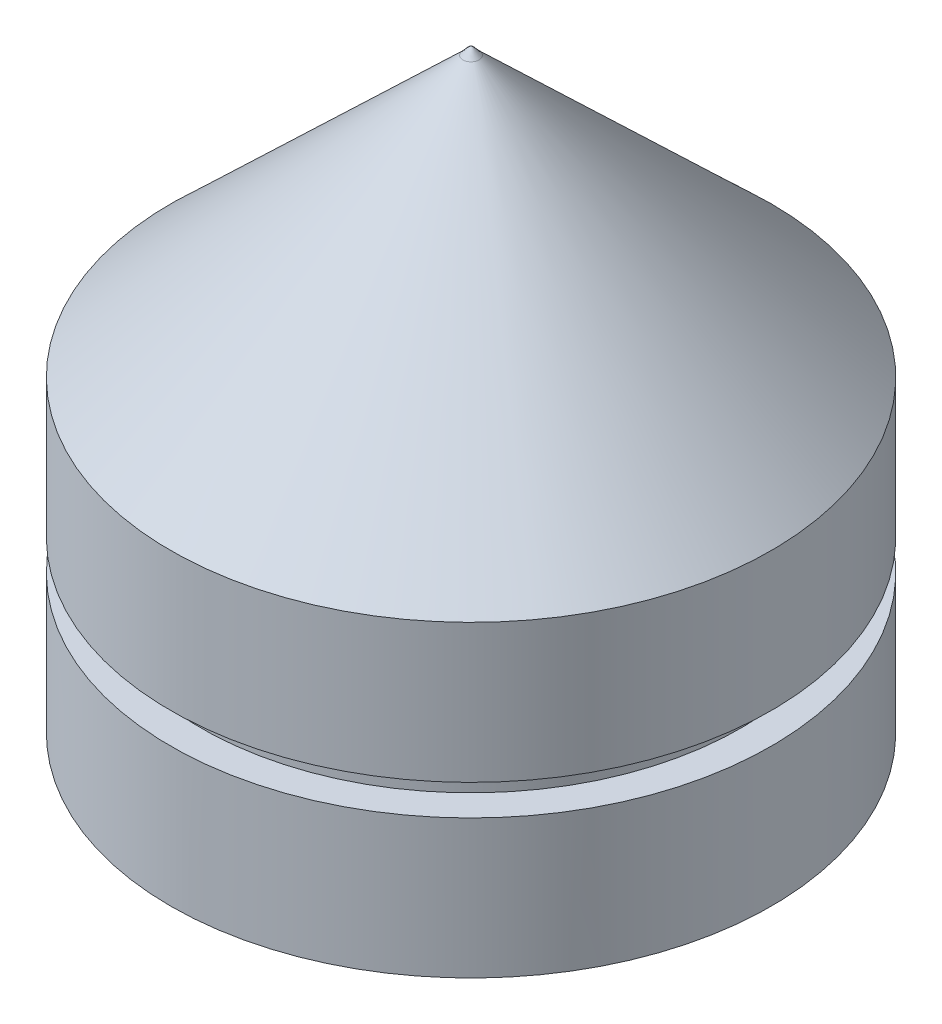
from build123d import *

# Parameters (mm, degrees)
SKETCH1_R           = 9.75
BOSS_EXTRUDE1_DEPTH = 10
SKETCH5_W           = 1
SKETCH5_H           = 1


with BuildPart() as part:
    # Sketch1 → Boss-Extrude1 (new body)
    with BuildSketch(Plane(origin=(0, 0, 0), x_dir=(1, 0, 0), z_dir=(0, 1, 0))):
        with Locations(Location((0, 0, 0), (0, 0, 270))):
            Circle(SKETCH1_R)
    extrude(amount=BOSS_EXTRUDE1_DEPTH)

    # Sketch2 → Revolve1 (revolve)
    with BuildSketch(Plane.XY, mode=Mode.PRIVATE) as revolve1_sk:
        Polygon((0, 10), (0, 19.300191168), (9.75, 10), align=None)
    revolve(revolve1_sk.sketch.rotate(Axis((0, 0, 0), (0, 1, 0)), 90), axis=Axis((0, 0, 0), (0, 1, 0)))

    # Sketch3 → Cut-Revolve1 (revolve, cut)
    with BuildSketch(Plane.XY, mode=Mode.PRIVATE) as cut_revolve1_sk:
        Polygon((0, 19.300191168), (0, 19.050191168), (0.262091387, 19.050191168), align=None)
    revolve(cut_revolve1_sk.sketch.rotate(Axis((0, 19.050191168, 0), (0, 1, 0)), 90), axis=Axis((0, 19.050191168, 0), (0, 1, 0)), mode=Mode.SUBTRACT)

    # Sketch4 → Revolve2 (revolve)
    with BuildSketch(Plane.XY, mode=Mode.PRIVATE) as revolve2_sk:
        with BuildLine():
            Line((0, 19.050191168), (0, 19.300191168))
            add(Edge.make_bspline(
                [(0, 19.300191168), (0.070360222, 19.286498468), (0.134000153, 19.189472435), (0.262091387, 19.050191168)],
                knots=[0.5, 0.5, 0.5, 0.5, 1, 1, 1, 1], degree=3))
            Line((0.262091387, 19.050191168), (0, 19.050191168))
        make_face()
    revolve(revolve2_sk.sketch.rotate(Axis((0, 19.050191168, 0), (0, -1, 0)), 270), axis=Axis((0, 19.050191168, 0), (0, -1, 0)))

    # Sketch5 → Cut-Revolve2 (revolve, cut)
    with BuildSketch(Plane.XY, mode=Mode.PRIVATE) as cut_revolve2_sk:
        with Locations((-9.25, 5)):
            Rectangle(SKETCH5_W, SKETCH5_H)
    revolve(cut_revolve2_sk.sketch.rotate(Axis((0, 0, 0), (0, 1, 0)), 270), axis=Axis((0, 0, 0), (0, 1, 0)), mode=Mode.SUBTRACT)


solid = part.part
